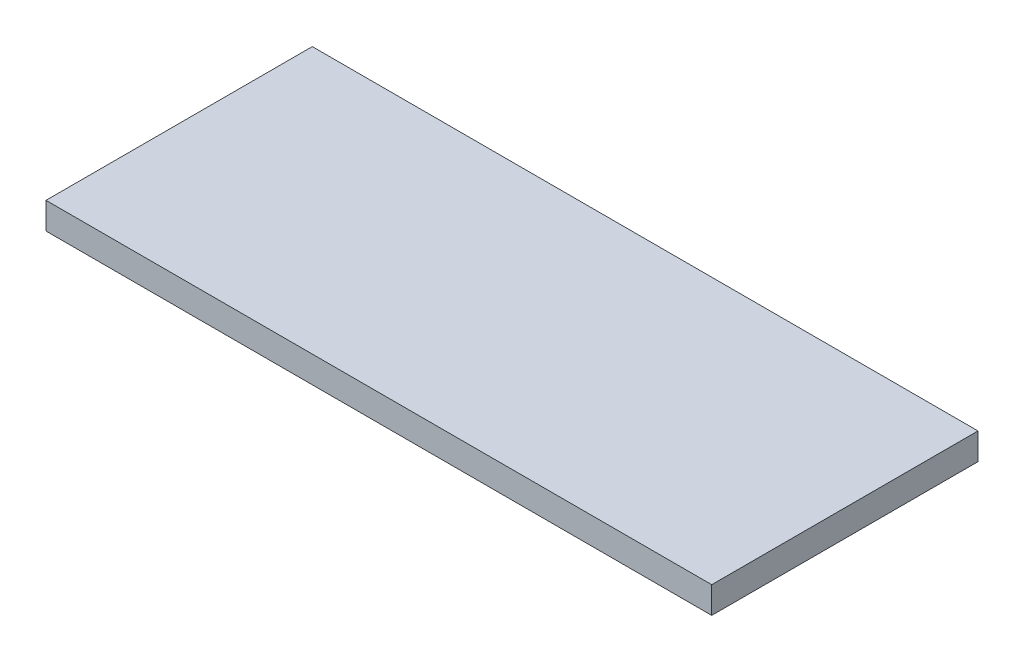
from build123d import *

# Parameters (mm, degrees)
OVEN_KESME_UST_TRAVERS_1_START = -200
SKETCH1_W                      = 500
SKETCH1_H                      = 20
OVEN_KESME_UST_TRAVERS_1_DEPTH = 200


with BuildPart() as part:
    # Sketch1 → OVEN_kesme_ust_travers_1 (new body)
    with BuildSketch(Plane.XY.offset(OVEN_KESME_UST_TRAVERS_1_START)):
        with Locations((350, 790)):
            Rectangle(SKETCH1_W, SKETCH1_H)
    extrude(amount=-OVEN_KESME_UST_TRAVERS_1_DEPTH)


solid = part.part
